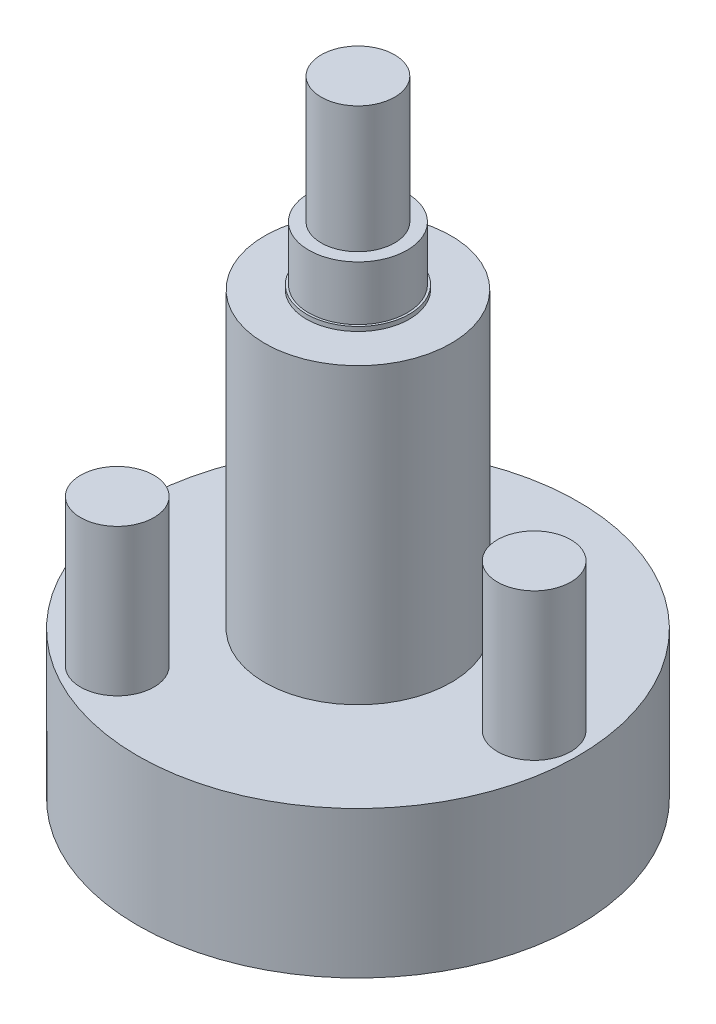
from build123d import *

# Parameters (mm, degrees)
SKETCH_1_R               = 2.5
EXTRUDE_1_DEPTH          = 5
SKETCH_2_R               = 3.5
EXTRUDE_2_DEPTH          = 0.3
SKETCH_3_R               = 15
EXTRUDE_3_DEPTH          = 10
SKETCH_4_R               = 6.35
EXTRUDE_4_DEPTH          = 10
SKETCH_5_R               = 6.35
EXTRUDE_5_DEPTH          = 10
SKETCH_6_R               = 3.5
EXTRUDE_6_DEPTH          = 0.3
SKETCH_7_R               = 3.35
EXTRUDE_7_DEPTH          = 3.7
SKETCH_8_R               = 2.5
EXTRUDE_8_DEPTH          = 3
EXTRUDE_START            = 3.7
SKETCH_9_R               = 3.35
EXTRUDE_9_DEPTH          = 3.7
SKETCH_10_R              = 2.5
EXTRUDE_10_DEPTH         = 5.6
SKETCH_11_R              = 2.5
EXTRUDE_11_DEPTH         = 10
PATTERN_CIRCULAR_1_COUNT = 3


with BuildPart() as part:
    # 草图1 → 凸台-拉伸1 (new body)
    with BuildSketch(Plane(origin=(0, 0, 0), x_dir=(1, 0, 0), z_dir=(0, 1, 0))):
        with Locations(Location((0, 0, 0), (0, 0, 270))):
            Circle(SKETCH_1_R)
    extrude(amount=EXTRUDE_1_DEPTH)

    # 草图2 → 凸台-拉伸2 (add)
    with BuildSketch(Plane(origin=(0, 5, 0), x_dir=(1, 0, 0), z_dir=(0, 1, 0))):
        with Locations(Location((0, 0, 0), (0, 0, 270))):
            Circle(SKETCH_2_R)
    extrude(amount=EXTRUDE_2_DEPTH)

    # 草图3 → 凸台-拉伸3 (add)
    with BuildSketch(Plane(origin=(0, 5.3, 0), x_dir=(1, 0, 0), z_dir=(0, 1, 0))):
        with Locations(Location((0, 0, 0), (0, 0, 270))):
            Circle(SKETCH_3_R)
    extrude(amount=EXTRUDE_3_DEPTH)

    # 草图4 → 凸台-拉伸4 (add)
    with BuildSketch(Plane(origin=(0, 15.3, 0), x_dir=(1, 0, 0), z_dir=(0, 1, 0))):
        with Locations(Location((0, 0, 0), (0, 0, 270))):
            Circle(SKETCH_4_R)
    extrude(amount=EXTRUDE_4_DEPTH)

    # 草图5 → 凸台-拉伸5 (add)
    with BuildSketch(Plane(origin=(0, 25.3, 0), x_dir=(1, 0, 0), z_dir=(0, 1, 0))):
        with Locations(Location((0, 0, 0), (0, 0, 270))):
            Circle(SKETCH_5_R)
    extrude(amount=EXTRUDE_5_DEPTH)

    # 草图6 → 凸台-拉伸6 (add)
    with BuildSketch(Plane(origin=(0, 35.3, 0), x_dir=(1, 0, 0), z_dir=(0, 1, 0))):
        with Locations(Location((0, 0, 0), (0, 0, 270))):
            Circle(SKETCH_6_R)
    extrude(amount=EXTRUDE_6_DEPTH)

    # 草图7 → 凸台-拉伸7 (add)
    with BuildSketch(Plane(origin=(0, 35.6, 0), x_dir=(1, 0, 0), z_dir=(0, 1, 0))):
        with Locations(Location((0, 0, 0), (0, 0, 270))):
            Circle(SKETCH_7_R)
    extrude(amount=EXTRUDE_7_DEPTH)

    # 草图8 → 凸台-拉伸8 (add)
    with BuildSketch(Plane(origin=(0, 39.3, 0), x_dir=(1, 0, 0), z_dir=(0, 1, 0))):
        with Locations(Location((0, 0, 0), (0, 0, 270))):
            Circle(SKETCH_8_R)
    extrude(amount=EXTRUDE_8_DEPTH)

    # 草图9 → 凸台-拉伸9 (add)
    with BuildSketch(Plane(origin=(0, 5, 0), x_dir=(-1, 0, 0), z_dir=(0, -1, 0)).offset(EXTRUDE_START)):
        with Locations(Location((0, 0, 0), (0, 0, 270))):
            Circle(SKETCH_9_R)
    extrude(amount=-EXTRUDE_9_DEPTH)

    # 草图10 → 凸台-拉伸10 (add)
    with BuildSketch(Plane(origin=(0, 42.3, 0), x_dir=(1, 0, 0), z_dir=(0, 1, 0))):
        with Locations(Location((0, 0, 0), (0, 0, 270))):
            Circle(SKETCH_10_R)
    extrude(amount=EXTRUDE_10_DEPTH)

    # 草图11 → 凸台-拉伸11 (add)
    with BuildSketch(Plane(origin=(0, 15.3, 0), x_dir=(1, 0, 0), z_dir=(0, 1, 0))):
        with Locations(Location((12, 0, 0), (0, 0, 270))):
            Circle(SKETCH_11_R)
    extrude_11 = extrude(amount=EXTRUDE_11_DEPTH)

    # 阵列(圆周)1: 凸台-拉伸11 ×3 about axis
    pattern_circular_1_axis = Axis((0, 0, 0), (0, 1, 0))
    for i in range(1, PATTERN_CIRCULAR_1_COUNT):
        add(extrude_11.rotate(pattern_circular_1_axis, i * 360 / PATTERN_CIRCULAR_1_COUNT))


solid = part.part
